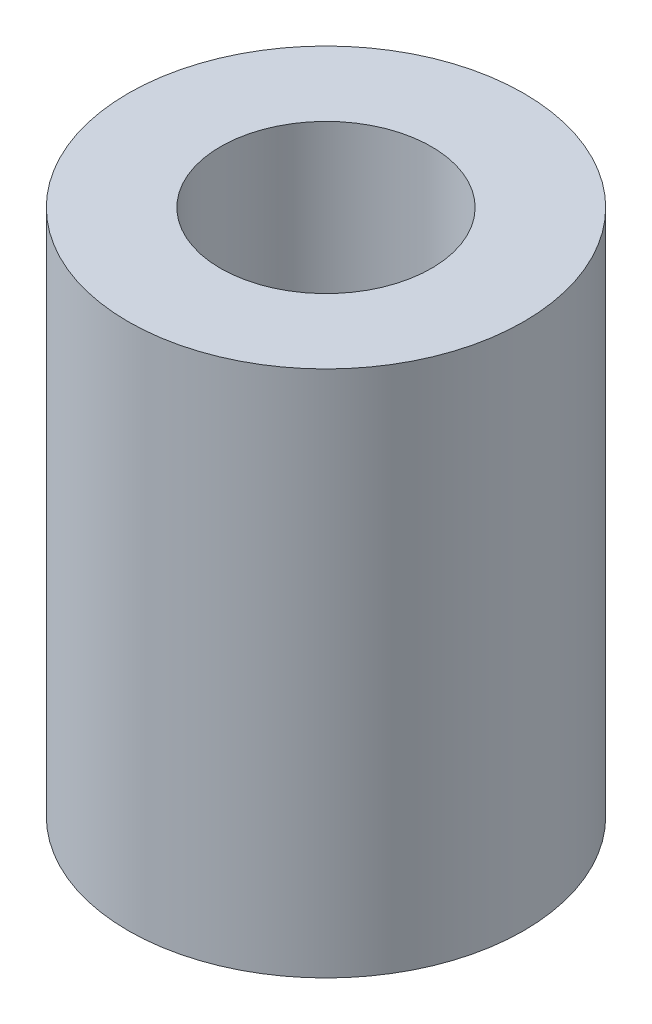
from build123d import *

# Parameters (mm, degrees)
SKETCH1_R           = 3
SKETCH1_R_2         = 1.6
BOSS_EXTRUDE1_DEPTH = 8


with BuildPart() as part:
    # Sketch1 → Boss-Extrude1 (new body)
    with BuildSketch(Plane(origin=(0, 0, 0), x_dir=(1, 0, 0), z_dir=(0, 1, 0))):
        with Locations(Location((0, 0, 0), (0, 0, 270))):
            Circle(SKETCH1_R)
        with Locations(Location((0, 0, 0), (0, 0, 270))):
            Circle(SKETCH1_R_2, mode=Mode.SUBTRACT)
    extrude(amount=BOSS_EXTRUDE1_DEPTH)


solid = part.part
